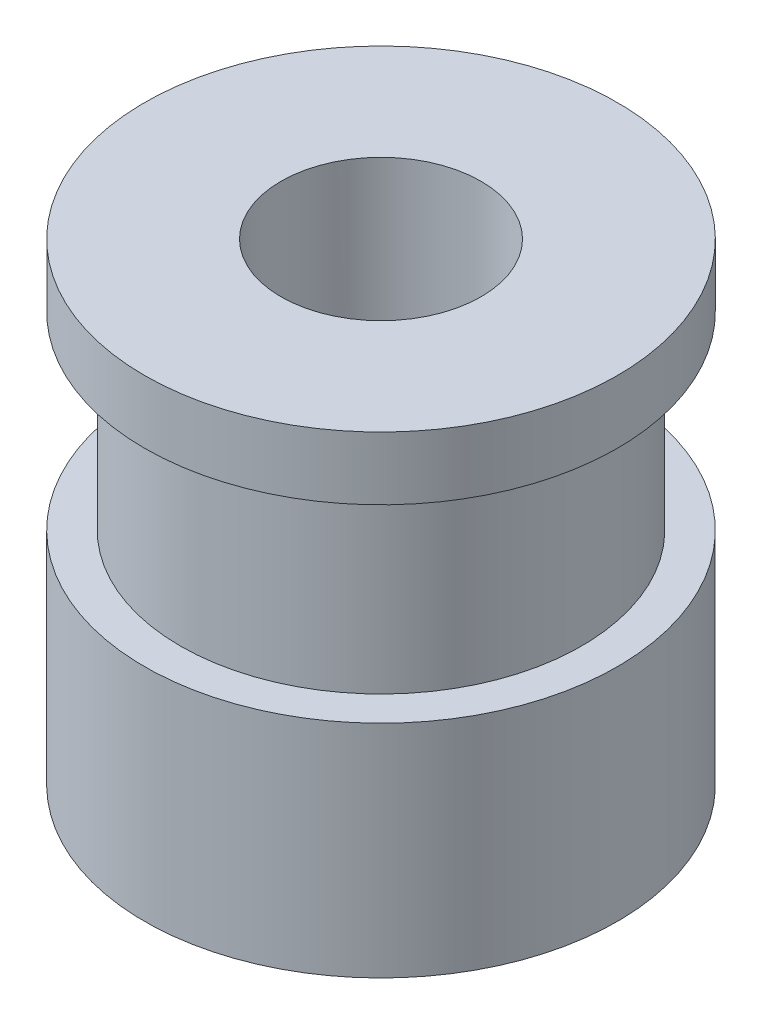
from build123d import *

# Parameters (mm, degrees)
SKETCH1_R                = 6.366
SKETCH1_R_2              = 3.175
BOSS_EXTRUDE1_DEPTH      = 10
BOSS_EXTRUDE2_START      = -2
SKETCH2_R                = 7.5
SKETCH2_R_2              = 3.175
BOSS_EXTRUDE2_DEPTH      = 2
BOSS_EXTRUDE3_DEPTH      = 5
BOSS_EXTRUDE3_DEPTH_BACK = 2
SKETCH3_R                = 7.5
SKETCH3_R_2              = 3.175


with BuildPart() as part:
    # Sketch1 → Boss-Extrude1 (new body)
    with BuildSketch(Plane(origin=(0, 0, 0), x_dir=(1, 0, 0), z_dir=(0, 1, 0))):
        with Locations(Location((0, 0, 0), (0, 0, 270))):
            Circle(SKETCH1_R)
        with Locations(Location((0, 0, 0), (0, 0, 270))):
            Circle(SKETCH1_R_2, mode=Mode.SUBTRACT)
    extrude(amount=BOSS_EXTRUDE1_DEPTH)

    # Sketch2 → Boss-Extrude2 (add)
    with BuildSketch(Plane(origin=(0, 10, 0), x_dir=(1, 0, 0), z_dir=(0, 1, 0)).offset(BOSS_EXTRUDE2_START)):
        with Locations(Location((0, 0, 0), (0, 0, 270))):
            Circle(SKETCH2_R)
        with Locations(Location((0, 0, 0), (0, 0, 270))):
            Circle(SKETCH2_R_2, mode=Mode.SUBTRACT)
    extrude(amount=BOSS_EXTRUDE2_DEPTH)

    # Sketch3 → Boss-Extrude3 (add, two sides: drawn at the far end of the back side and taken through both)
    with BuildSketch(Plane.XZ.offset(-BOSS_EXTRUDE3_DEPTH_BACK)):
        with Locations(Location((0, 0, 0), (0, 0, 90))):
            Circle(SKETCH3_R)
        with Locations(Location((0, 0, 0), (0, 0, 270))):
            Circle(SKETCH3_R_2, mode=Mode.SUBTRACT)
    extrude(amount=BOSS_EXTRUDE3_DEPTH + BOSS_EXTRUDE3_DEPTH_BACK)


solid = part.part
